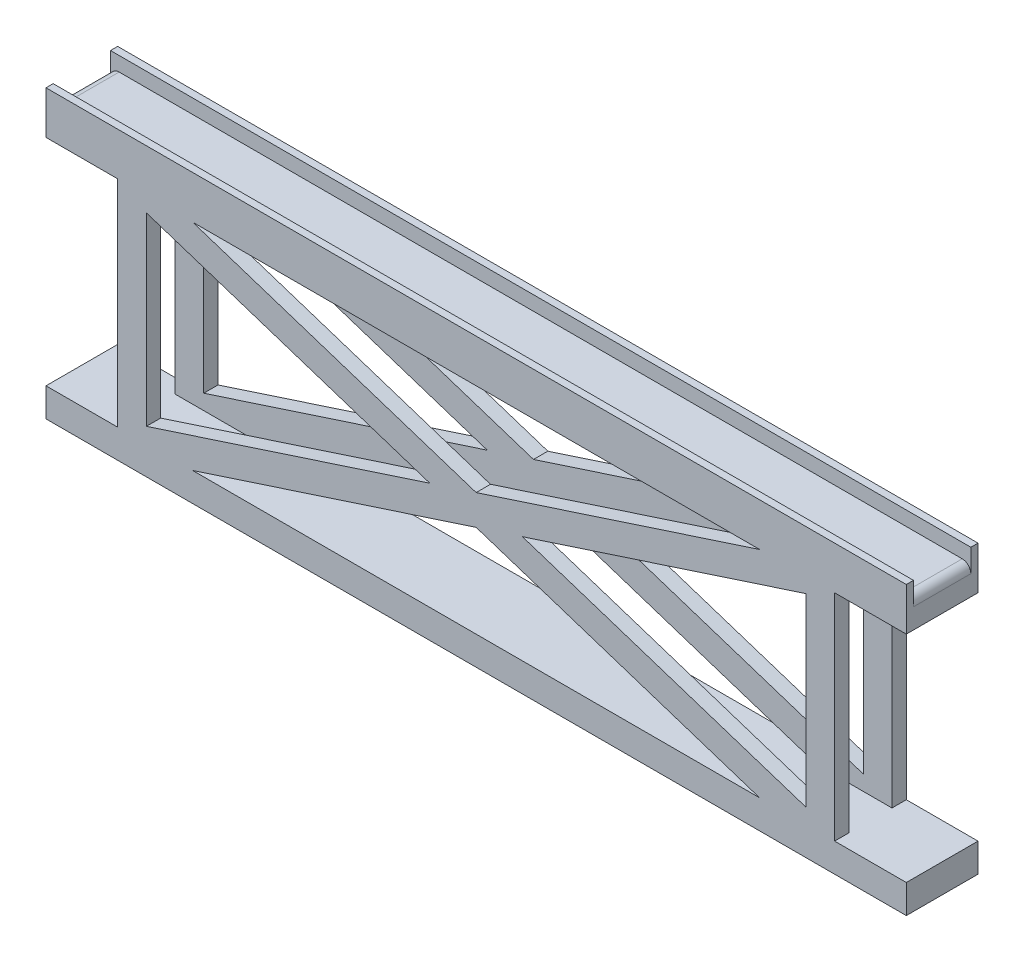
from build123d import *

# Parameters (mm, degrees)
ESBO_O1_W                = 3000
ESBO_O1_H                = 250
RESSALTO_EXTRUS_O1_DEPTH = 1000
ESBO_O2_W                = 250
ESBO_O2_H                = 750
CORTE_EXTRUS_O1_DEPTH    = 250
CORTE_EXTRUS_O2_REACH    = 2938.835
ESBO_O3_W                = 150
ESBO_O3_H                = 750
ESBO_O4_W                = 3000
ESBO_O4_H                = 200
CORTE_EXTRUS_O3_DEPTH    = 50
FILETE1_R                = 30


with BuildPart() as part:
    # Esboço1 → Ressalto-extrusão1 (new body)
    with BuildSketch(Plane(origin=(0, 0, 0), x_dir=(1, 0, 0), z_dir=(0, 1, 0))):
        with Locations((1500, 125)):
            Rectangle(ESBO_O1_W, ESBO_O1_H)
    extrude(amount=RESSALTO_EXTRUS_O1_DEPTH)

    # Esboço2 → Corte-extrusão1 (cut)
    with BuildSketch(Plane.XY):
        with Locations((125, 475)):
            Rectangle(ESBO_O2_W, ESBO_O2_H)
        Polygon((1338.720394621, 475), (350, 797.408824333), (350, 152.591175667), align=None)
        Polygon((2488.720394621, 850), (511.279605379, 850), (1500, 527.591175667), align=None)
        Polygon((2488.720394621, 100), (1500, 422.408824333), (511.279605379, 100), align=None)
        Polygon((2650, 797.408824333), (1661.279605379, 475), (2650, 152.591175667), align=None)
        with Locations((2875, 475)):
            Rectangle(ESBO_O2_W, ESBO_O2_H)
    extrude(amount=-CORTE_EXTRUS_O1_DEPTH, mode=Mode.SUBTRACT)

    # Corte-extrusão2: up to this face of the body (flat: up to its plane)
    corte_extrus_o2_end = Plane(part.part.faces().sort_by_distance((2750, 475, -125))[0])
    # Esboço3 → Corte-extrusão2 (cut, up to the picked face)
    with BuildSketch(Plane.ZY.offset(-250), mode=Mode.PRIVATE) as corte_extrus_o2_sk1:
        with Locations((-125, 475)):
            Rectangle(ESBO_O3_W, ESBO_O3_H)
    corte_extrus_o2_tool1 = split(extrude(corte_extrus_o2_sk1.sketch, amount=-CORTE_EXTRUS_O2_REACH, mode=Mode.PRIVATE), bisect_by=corte_extrus_o2_end, keep=Keep.BOTH, mode=Mode.PRIVATE)
    add(corte_extrus_o2_tool1.solids().sort_by(Axis((250, 475, -125), (1, 0, 0)))[0], mode=Mode.SUBTRACT)

    # Esboço4 → Corte-extrusão3 (cut)
    with BuildSketch(Plane(origin=(0, 1000, 0), x_dir=(1, 0, 0), z_dir=(0, 1, 0))):
        with Locations((1500, 125)):
            Rectangle(ESBO_O4_W, ESBO_O4_H)
    extrude(amount=-CORTE_EXTRUS_O3_DEPTH, mode=Mode.SUBTRACT)

    # Filete1
    filete1_edges = [part.edges().sort_by_distance(p)[0] for p in [
        (3000, 950, -125),
        (0, 950, -125),
    ]]
    fillet(filete1_edges, radius=FILETE1_R)


solid = part.part
